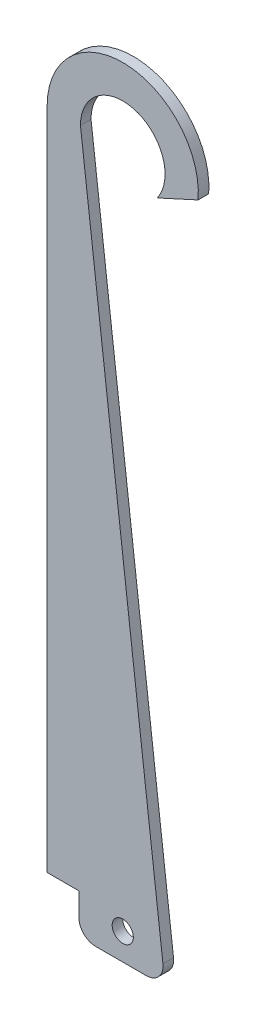
from build123d import *

# Parameters (mm, degrees)
SKETCH1_R           = 6.35
BOSS_EXTRUDE1_DEPTH = 6.35
FILLET1_R           = 10


with BuildPart() as part:
    # Sketch1 → Boss-Extrude1 (new body)
    with BuildSketch(Plane.XY):
        with BuildLine():
            Line((3.331127109, 389.92455355), (27.90992579, 401.162728042))
            ThreePointArc((27.90992579, 401.162728042), (-15.607198263, 450.028916488), (-62.759573024, 404.660447113))
            Line((-62.759573024, 404.660447113), (-62.759573024, 6.090179643))
            Line((-62.759573024, 6.090179643), (-43.715258354, 6.090179643))
            Line((-43.715258354, 6.090179643), (-43.715258354, -17.785820357))
            Line((-43.715258354, -17.785820357), (8.125653236, -17.785820357))
            Line((8.125653236, -17.785820357), (-42.757358599, 404.660447113))
            ThreePointArc((-42.757358599, 404.660447113), (-17.357358599, 430.060447113), (8.042641401, 404.660447113))
            ThreePointArc((8.042641401, 404.660447113), (6.83610681, 396.925058855), (3.331127109, 389.92455355))
        make_face()
        with Locations((-17.357358599, -1.739552887)):
            Circle(SKETCH1_R, mode=Mode.SUBTRACT)
    extrude(amount=BOSS_EXTRUDE1_DEPTH)

    # Fillet1
    fillet1_edges = [part.edges().sort_by_distance(p)[0] for p in [
        (8.125653236, -17.785820357, 3.175),
        (-43.715258354, -17.785820357, 3.175),
    ]]
    fillet(fillet1_edges, radius=FILLET1_R)


solid = part.part
